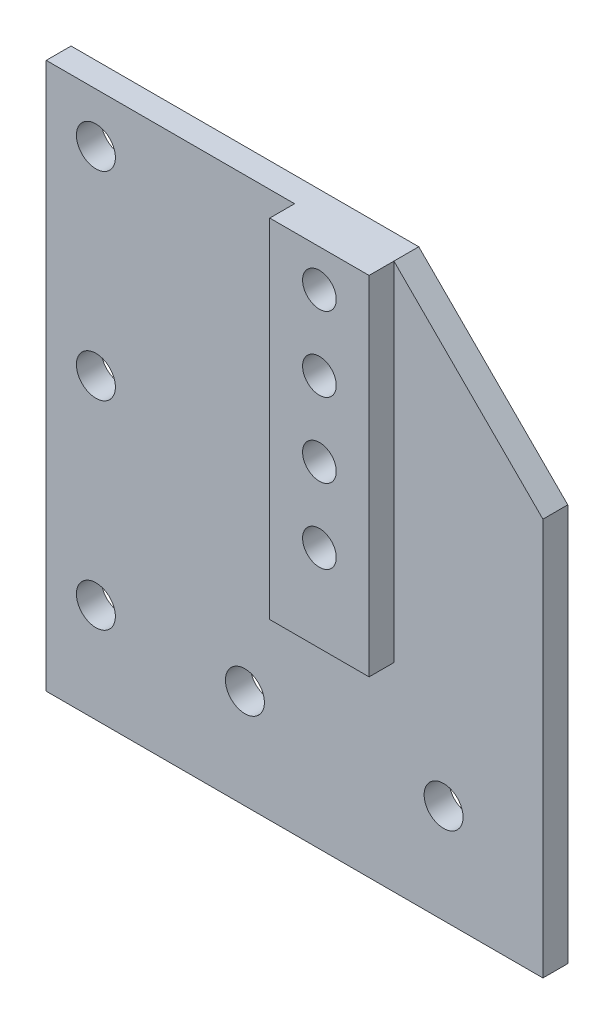
from build123d import *

# Parameters (mm, degrees)
BOSS_EXTRUDE1_DEPTH    = 3.175
F_10_CLEARANCE_HOLE1_D = 4.9784
BOSS_EXTRUDE2_DEPTH    = 3.175
F_8_CLEARANCE_HOLE1_D  = 4.3053


with BuildPart() as part:
    # Sketch1 → Boss-Extrude1 (new body)
    with BuildSketch(Plane.XY):
        Polygon((-254.000000508, -12.7), (-266.700000508, -12.7), (-266.700000508, 57.15), (-254.000000508, 57.15), (-222.250000508, 57.15), (-203.200000508, 38.1), (-203.200000508, 12.7), (-203.200000508, -12.7), align=None)
    extrude(amount=BOSS_EXTRUDE1_DEPTH)

    # #10 Clearance Hole1 (through all)
    with Locations(Plane.XY.offset(3.175)):
        with Locations((-260.350000508, 50.798866939), (-260.350000508, 25.4), (-260.350000508, 0), (-241.300000508, 0), (-215.900000508, 0)):
            Hole(F_10_CLEARANCE_HOLE1_D / 2)

    # Sketch5 → Boss-Extrude2 (add)
    with BuildSketch(Plane.XY.offset(3.175)):
        Polygon((-222.250000508, 57.15), (-234.950000508, 57.15), (-234.950000508, 12.7), (-222.250000508, 12.7), (-222.250000508, 50.8), align=None)
    extrude(amount=BOSS_EXTRUDE2_DEPTH)

    # #8 Clearance Hole1 (through all)
    with Locations(Plane.XY.offset(6.35)):
        with Locations((-228.600000508, 42.8625), (-228.600000508, 52.3875), (-228.600000508, 33.3375), (-228.600000508, 23.8125)):
            Hole(F_8_CLEARANCE_HOLE1_D / 2)


solid = part.part
